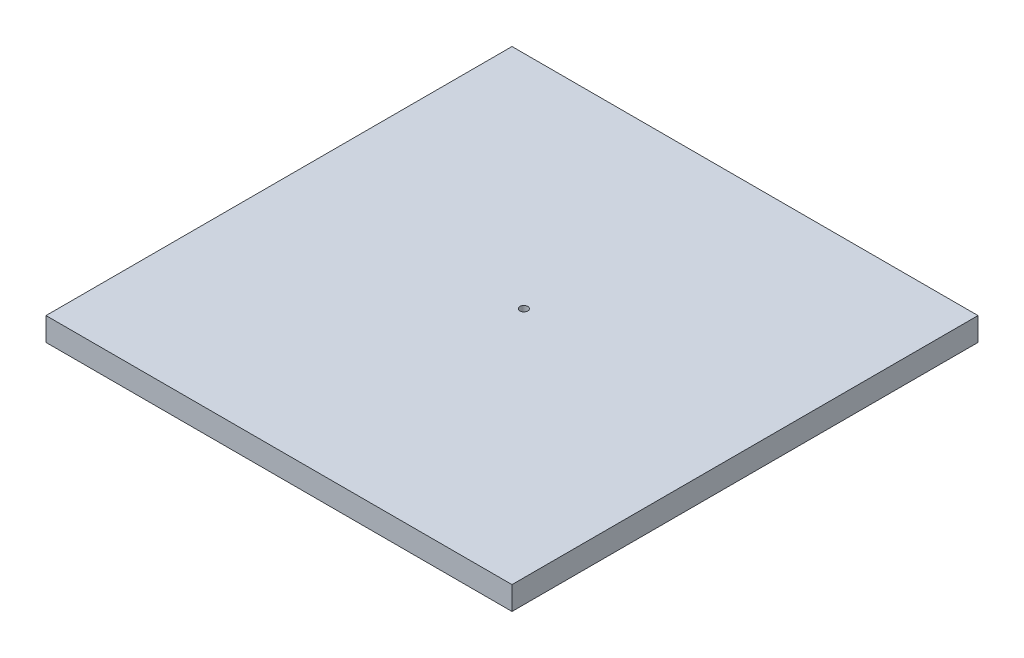
from build123d import *

# Parameters (mm, degrees)
ESQUISSE1_W        = 400
ESQUISSE1_H        = 20
BOSS_EXTRU_1_DEPTH = 400
TROU_TARAUD_M81_D  = 6.8


with BuildPart() as part:
    # Esquisse1 → Boss.-Extru.1 (new body)
    with BuildSketch(Plane.XY):
        with Locations((0, 10)):
            Rectangle(ESQUISSE1_W, ESQUISSE1_H)
    extrude(amount=BOSS_EXTRU_1_DEPTH)

    # Trou taraudé M81 (through all)
    with Locations(Plane(origin=(0, 0, 0), x_dir=(-1, 0, 0), z_dir=(0, -1, 0))):
        with Locations((0, -189.819719024)):
            Hole(TROU_TARAUD_M81_D / 2)


solid = part.part
